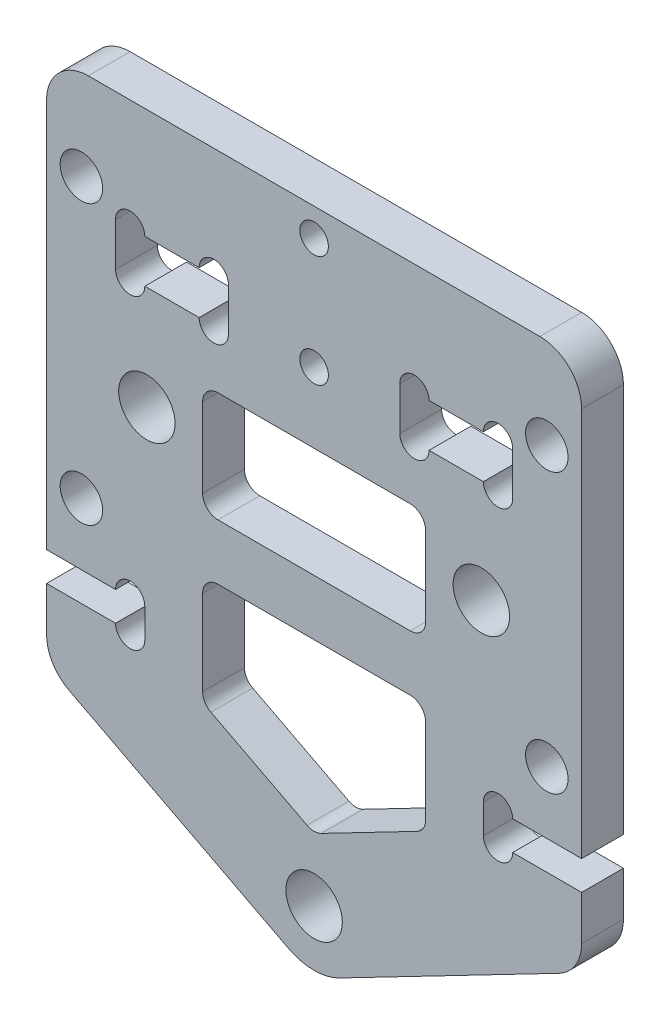
from build123d import *

# Parameters (mm, degrees)
SKETCH_1_W          = 38.4
SKETCH_1_H          = 47.5
SKETCH_1_R          = 2.025
EXTRUDE_1_DEPTH     = 3
SKETCH_2_R          = 1.025
CUT_EXTRUDE_1_DEPTH = 43
SKETCH_3_W          = 7.1
SKETCH_3_H          = 2.1
CUT_EXTRUDE_2_DEPTH = 3
CUT_EXTRUDE_3_DEPTH = 3
SKETCH_5_R          = 1.525
CUT_EXTRUDE_4_DEPTH = 3
SKETCH_6_W          = 8.1
SKETCH_6_H          = 3.1
CUT_EXTRUDE_5_DEPTH = 3
SKETCH_7_R          = 1.05
CUT_EXTRUDE_6_DEPTH = 3
CUT_EXTRUDE_7_DEPTH = 3
FILLET_1_R          = 3
SKETCH_9_W          = 16
SKETCH_9_H          = 7.89799579
CUT_EXTRUDE_8_DEPTH = 3
FILLET_2_R          = 1.1


with BuildPart() as part:
    # 草图1 → 凸台-拉伸1 (new body)
    with BuildSketch(Plane.XY):
        with Locations((0, 7.25)):
            Rectangle(SKETCH_1_W, SKETCH_1_H)
        with Locations((-12, 12.5)):
            Circle(SKETCH_1_R, mode=Mode.SUBTRACT)
        with Locations((12, 12.5)):
            Circle(SKETCH_1_R, mode=Mode.SUBTRACT)
        with Locations((0, -12.5)):
            Circle(SKETCH_1_R, mode=Mode.SUBTRACT)
    extrude(amount=EXTRUDE_1_DEPTH)

    # 草图2 → 切除-拉伸1 (cut)
    with BuildSketch(Plane(origin=(0, 0, 0), x_dir=(-1, 0, 0), z_dir=(0, 0, -1))):
        with Locations((0, 29)):
            Circle(SKETCH_2_R)
        with Locations((0, 21)):
            Circle(SKETCH_2_R)
    extrude(amount=-CUT_EXTRUDE_1_DEPTH, mode=Mode.SUBTRACT)

    # 草图3 → 切除-拉伸2 (cut)
    with BuildSketch(Plane.XY.offset(3)):
        with Locations((15.7, -1)):
            Rectangle(SKETCH_3_W, SKETCH_3_H)
        with Locations((-15.7, -1)):
            Rectangle(SKETCH_3_W, SKETCH_3_H)
    extrude(amount=-CUT_EXTRUDE_2_DEPTH, mode=Mode.SUBTRACT)

    # 草图4 → 切除-拉伸3 (cut)
    with BuildSketch(Plane.XY.offset(3)):
        with BuildLine():
            ThreePointArc((-12.15, -2.05), (-12.45753788, -1.30753788), (-13.2, -1))
            ThreePointArc((-13.2, -1), (-13.94246212, -1.30753788), (-14.25, -2.05))
            Line((-14.25, -2.05), (-12.15, -2.05))
        make_face()
        with BuildLine():
            ThreePointArc((-14.25, -2.05), (-13.2, -3.1), (-12.15, -2.05))
            Line((-12.15, -2.05), (-14.25, -2.05))
        make_face()
        with BuildLine():
            Line((-14.25, 0.05), (-12.15, 0.05))
            ThreePointArc((-12.15, 0.05), (-13.2, 1.1), (-14.25, 0.05))
        make_face()
        with BuildLine():
            ThreePointArc((-13.2, -1), (-12.45753788, -0.69246212), (-12.15, 0.05))
            Line((-12.15, 0.05), (-14.25, 0.05))
            ThreePointArc((-14.25, 0.05), (-13.94246212, -0.69246212), (-13.2, -1))
        make_face()
        with BuildLine():
            ThreePointArc((14.25, -2.05), (13.94246212, -1.30753788), (13.2, -1))
            ThreePointArc((13.2, -1), (12.45753788, -1.30753788), (12.15, -2.05))
            Line((12.15, -2.05), (14.25, -2.05))
        make_face()
        with BuildLine():
            ThreePointArc((12.15, -2.05), (13.2, -3.1), (14.25, -2.05))
            Line((14.25, -2.05), (12.15, -2.05))
        make_face()
        with BuildLine():
            Line((12.15, 0.05), (14.25, 0.05))
            ThreePointArc((14.25, 0.05), (13.2, 1.1), (12.15, 0.05))
        make_face()
        with BuildLine():
            ThreePointArc((13.2, -1), (13.94246212, -0.69246212), (14.25, 0.05))
            Line((14.25, 0.05), (12.15, 0.05))
            ThreePointArc((12.15, 0.05), (12.45753788, -0.69246212), (13.2, -1))
        make_face()
    extrude(amount=-CUT_EXTRUDE_3_DEPTH, mode=Mode.SUBTRACT)

    # 草图5 → 切除-拉伸4 (cut)
    with BuildSketch(Plane(origin=(0, 0, 0), x_dir=(-1, 0, 0), z_dir=(0, 0, -1))):
        with Locations((16.7, 4.5)):
            Circle(SKETCH_5_R)
        with Locations((16.7, 24.5)):
            Circle(SKETCH_5_R)
        with Locations((-16.7, 24.5)):
            Circle(SKETCH_5_R)
        with Locations((-16.7, 4.5)):
            Circle(SKETCH_5_R)
    extrude(amount=-CUT_EXTRUDE_4_DEPTH, mode=Mode.SUBTRACT)

    # 草图6 → 切除-拉伸5 (cut)
    with BuildSketch(Plane.XY.offset(3)):
        with Locations((-10.2, 21.5)):
            Rectangle(SKETCH_6_W, SKETCH_6_H)
    cut_extrude_5 = extrude(amount=-CUT_EXTRUDE_5_DEPTH, mode=Mode.SUBTRACT)

    # 草图7 → 切除-拉伸6 (cut)
    with BuildSketch(Plane.XY.offset(3)):
        with Locations((-13.2, 19.95)):
            Circle(SKETCH_7_R)
        with Locations((-13.2, 23.05)):
            Circle(SKETCH_7_R)
        with Locations((-7.2, 23.05)):
            Circle(SKETCH_7_R)
        with Locations((-7.2, 19.95)):
            Circle(SKETCH_7_R)
    cut_extrude_6 = extrude(amount=-CUT_EXTRUDE_6_DEPTH, mode=Mode.SUBTRACT)

    # 镜向1: 切除-拉伸5, 切除-拉伸6 across plane
    add(cut_extrude_5.mirror(Plane(origin=(0, 0, 0), x_dir=(0, 0, 1), z_dir=(1, 0, 0))), mode=Mode.SUBTRACT)
    add(cut_extrude_6.mirror(Plane(origin=(0, 0, 0), x_dir=(0, 0, 1), z_dir=(1, 0, 0))), mode=Mode.SUBTRACT)

    # 草图8 → 切除-拉伸7 (cut)
    with BuildSketch(Plane.XY.offset(3)):
        with BuildLine():
            Line((-19.2, -16.5), (0, -16.5))
            ThreePointArc((0, -16.5), (-0.947626647, -16.38612966), (-1.84130001, -16.051001869))
            Line((-1.84130001, -16.051001869), (-19.2, -7.05))
            Line((-19.2, -7.05), (-19.2, -16.5))
        make_face()
        with BuildLine():
            Line((19.2, -7.05), (1.84130001, -16.051001869))
            ThreePointArc((1.84130001, -16.051001869), (0.947626647, -16.38612966), (0, -16.5))
            Line((0, -16.5), (19.2, -16.5))
            Line((19.2, -16.5), (19.2, -7.05))
        make_face()
    extrude(amount=-CUT_EXTRUDE_7_DEPTH, mode=Mode.SUBTRACT)

    # 圆角1
    fillet_1_edges = [part.edges().sort_by_distance(p)[0] for p in [
        (-19.2, -7.05, 1.5),
        (19.2, -7.05, 1.5),
        (-19.2, 31, 1.5),
        (19.2, 31, 1.5),
    ]]
    fillet(fillet_1_edges, radius=FILLET_1_R)

    # 草图9 → 切除-拉伸8 (cut)
    with BuildSketch(Plane(origin=(0, 0, 0), x_dir=(-1, 0, 0), z_dir=(0, 0, -1))):
        Polygon((8, 4.05200421), (-8, 4.05200421), (-8, -3.845991579), (0, -7.99422935), (8, -3.845991579), align=None)
        with Locations((0, 12.001002105)):
            Rectangle(SKETCH_9_W, SKETCH_9_H)
    extrude(amount=-CUT_EXTRUDE_8_DEPTH, mode=Mode.SUBTRACT)

    # 圆角2
    fillet_2_edges = [part.edges().sort_by_distance(p)[0] for p in [
        (8, -3.845991579, 1.5),
        (0, -7.99422935, 1.5),
        (-8, -3.845991579, 1.5),
        (-8, 4.05200421, 1.5),
        (8, 4.05200421, 1.5),
        (-8, 8.05200421, 1.5),
        (-8, 15.95, 1.5),
        (8, 15.95, 1.5),
        (8, 8.05200421, 1.5),
    ]]
    fillet(fillet_2_edges, radius=FILLET_2_R)


solid = part.part
